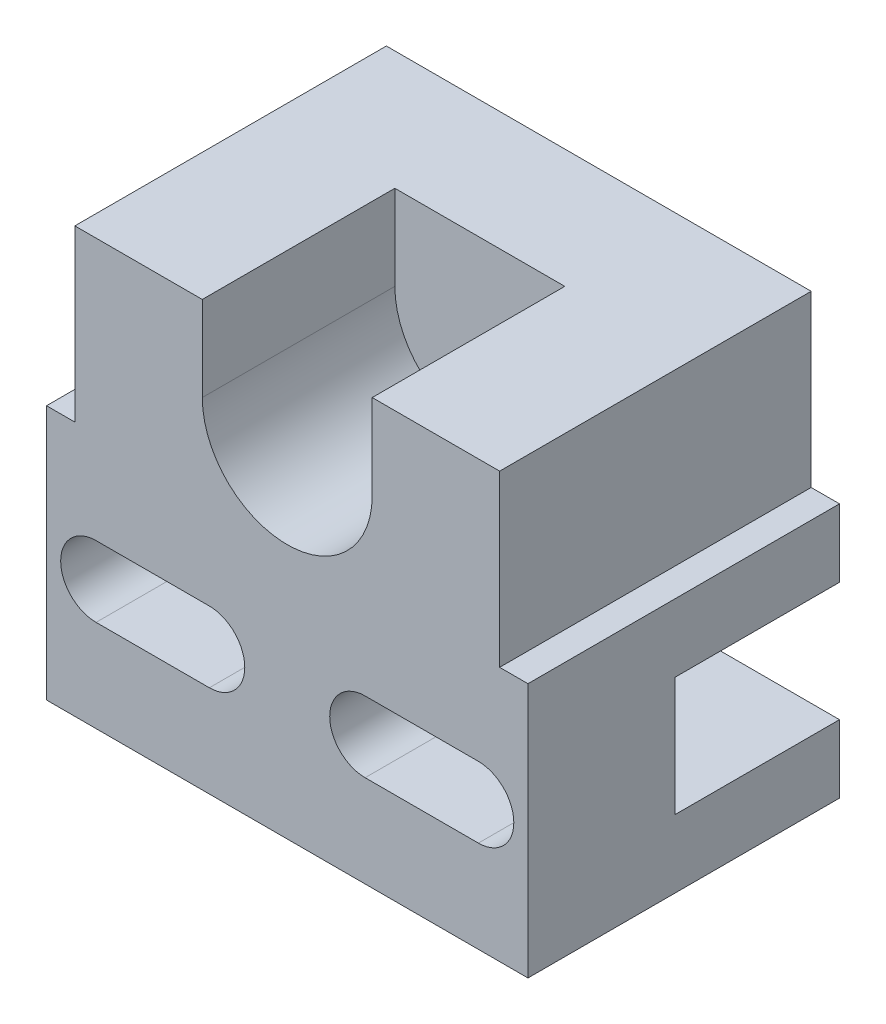
from build123d import *

# Parameters (mm, degrees)
BOSS_EXTRUDE1_DEPTH = 11
CUT_EXTRUDE1_DEPTH  = 7
SKETCH4_R           = 1.6
CUT_EXTRUDE2_DEPTH  = 19.607794066
SKETCH5_R           = 1.25
CUT_EXTRUDE3_DEPTH  = 21.451161336
CUT_EXTRUDE4_DEPTH  = 21.451161336
CUT_EXTRUDE5_DEPTH  = 5.8
SKETCH9_W           = 6.962435565
SKETCH9_H           = 4.2
CUT_EXTRUDE6_DEPTH  = 5.8
BOSS_EXTRUDE3_START = 0.2
BOSS_EXTRUDE3_DEPTH = 0.2
BOSS_EXTRUDE4_DEPTH = 7.3
CUT_EXTRUDE7_DEPTH  = 1.6


with BuildPart() as part:
    # Sketch1 → Boss-Extrude1 (new body)
    with BuildSketch(Plane.XY):
        Polygon((-8.5, 0), (8.5, 0), (8.5, 9), (7.5, 9), (7.5, 15), (-7.5, 15), (-7.5, 9), (-8.5, 9), align=None)
    extrude(amount=BOSS_EXTRUDE1_DEPTH)

    # Sketch2 → Cut-Extrude1 (cut)
    with BuildSketch(Plane.XY.offset(11)):
        with BuildLine():
            Line((3, 18), (3, 12))
            ThreePointArc((3, 12), (0, 9), (-3, 12))
            Line((-3, 12), (-3, 18))
            ThreePointArc((-3, 18), (0, 21), (3, 18))
        make_face()
    extrude(amount=-CUT_EXTRUDE1_DEPTH, mode=Mode.SUBTRACT)

    # Sketch4 → Cut-Extrude2 (cut, through all)
    with BuildSketch(Plane.XY.offset(4)):
        with Locations((0, 12)):
            Circle(SKETCH4_R)
    extrude(amount=-CUT_EXTRUDE2_DEPTH, mode=Mode.SUBTRACT)

    # Sketch5 → Cut-Extrude3 (cut, through all)
    with BuildSketch(Plane.XY.offset(11)):
        with Locations((-4.75, 4.5)):
            Circle(SKETCH5_R)
        with Locations(Location((4.75, 4.5, 0), (0, 0, 180))):
            Circle(SKETCH5_R)
    extrude(amount=-CUT_EXTRUDE3_DEPTH, mode=Mode.SUBTRACT)

    # Sketch7 → Cut-Extrude4 (cut, through all)
    with BuildSketch(Plane.XY.offset(11)):
        with BuildLine():
            Line((-6.75, 5.75), (-2.75, 5.75))
            ThreePointArc((-2.75, 5.75), (-1.5, 4.5), (-2.75, 3.25))
            Line((-2.75, 3.25), (-6.75, 3.25))
            ThreePointArc((-6.75, 3.25), (-8, 4.5), (-6.75, 5.75))
        make_face()
        with BuildLine():
            Line((6.75, 3.25), (2.75, 3.25))
            ThreePointArc((2.75, 3.25), (1.5, 4.5), (2.75, 5.75))
            Line((2.75, 5.75), (6.75, 5.75))
            ThreePointArc((6.75, 5.75), (8, 4.5), (6.75, 3.25))
        make_face()
    extrude(amount=-CUT_EXTRUDE4_DEPTH, mode=Mode.SUBTRACT)

    # Sketch8 → Cut-Extrude5 (cut)
    with BuildSketch(Plane(origin=(0, 0, 0), x_dir=(-1, 0, 0), z_dir=(0, 0, -1))):
        Polygon((-1.537564435, 6.6), (-3.962435565, 6.6), (-5.174871131, 4.5), (-3.962435565, 2.4), (-1.537564435, 2.4), (-0.325128869, 4.5), align=None)
        Polygon((1.537564435, 6.6), (0.325128869, 4.5), (1.537564435, 2.4), (3.962435565, 2.4), (5.174871131, 4.5), (3.962435565, 6.6), align=None)
    extrude(amount=-CUT_EXTRUDE5_DEPTH, mode=Mode.SUBTRACT)

    # Sketch9 → Cut-Extrude6 (cut)
    with BuildSketch(Plane(origin=(0, 0, 5.8), x_dir=(-1, 0, 0), z_dir=(0, 0, -1))):
        with Locations((5.018782218, 4.5)):
            Rectangle(SKETCH9_W, SKETCH9_H)
        with Locations((-5.018782218, 4.5)):
            Rectangle(SKETCH9_W, SKETCH9_H)
    extrude(amount=CUT_EXTRUDE6_DEPTH, mode=Mode.SUBTRACT)

    # Sketch11 → Boss-Extrude3 (add)
    with BuildSketch(Plane.XY.offset(4).offset(BOSS_EXTRUDE3_START)):
        with BuildLine():
            Line((3, 15), (-3, 15))
            Line((-3, 15), (-3, 12))
            ThreePointArc((-3, 12), (0, 9), (3, 12))
            Line((3, 12), (3, 15))
        make_face()
    extrude(amount=-BOSS_EXTRUDE3_DEPTH)

    # Sketch12 → Boss-Extrude4 (add)
    with BuildSketch(Plane(origin=(0, 0, 5.8), x_dir=(-1, 0, 0), z_dir=(0, 0, -1))):
        with BuildLine():
            Line((1.5, 8.9), (1.5, 6.936860279))
            ThreePointArc((1.5, 6.936860279), (0, 5.436860279), (-1.5, 6.936860279))
            Line((-1.5, 6.936860279), (-1.5, 8.9))
            ThreePointArc((-1.5, 8.9), (0, 10.4), (1.5, 8.9))
        make_face()
        with BuildLine():
            Line((1.5, 2.063139721), (1.5, 1.5))
            ThreePointArc((1.5, 1.5), (0, 0), (-1.5, 1.5))
            Line((-1.5, 1.5), (-1.5, 2.063139721))
            ThreePointArc((-1.5, 2.063139721), (0, 3.563139721), (1.5, 2.063139721))
        make_face()
    extrude(amount=BOSS_EXTRUDE4_DEPTH)

    # Sketch13 → Cut-Extrude7 (cut)
    with BuildSketch(Plane.XY.offset(5.8)):
        with BuildLine():
            ThreePointArc((1.42730909, 9.361290323), (0, 10.4), (-1.42730909, 9.361290323))
            ThreePointArc((-1.42730909, 9.361290323), (0, 9), (1.42730909, 9.361290323))
        make_face()
    extrude(amount=-CUT_EXTRUDE7_DEPTH, mode=Mode.SUBTRACT)


solid = part.part
